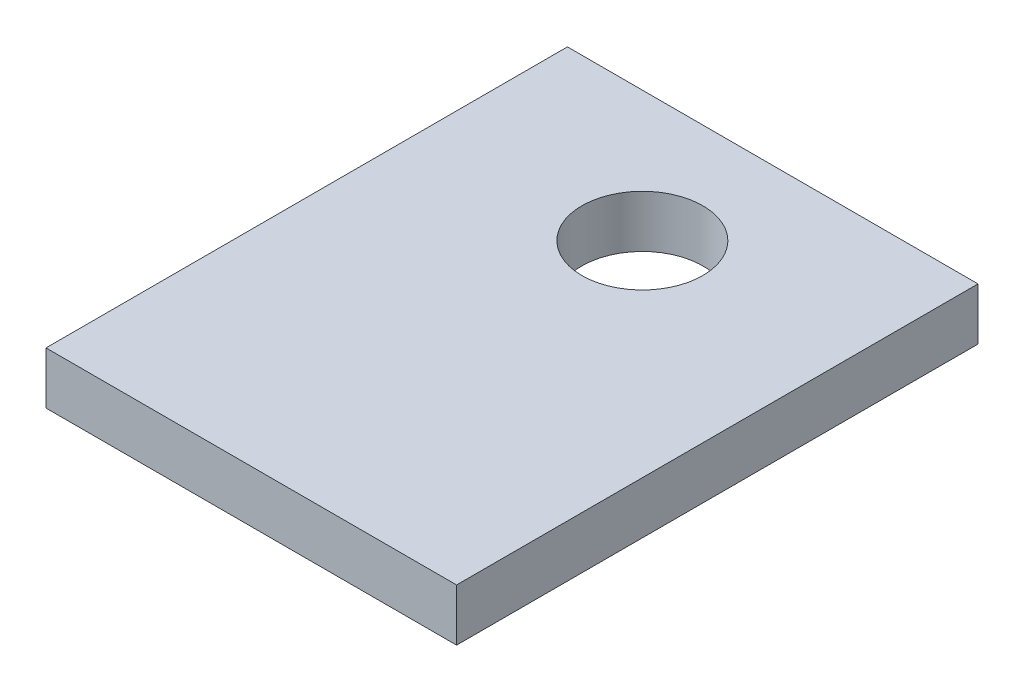
from build123d import *

# Parameters (mm, degrees)
SKETCH1_W           = 10
SKETCH1_H           = 12.7
SKETCH1_R           = 1.4732
BOSS_EXTRUDE1_DEPTH = 1.27


with BuildPart() as part:
    # Sketch1 → Boss-Extrude1 (new body)
    with BuildSketch(Plane(origin=(0, 0, 0), x_dir=(1, 0, 0), z_dir=(0, 1, 0))):
        with Locations((5, -6.35)):
            Rectangle(SKETCH1_W, SKETCH1_H)
        with Locations(Location((5, -3.175, 0), (0, 0, 270))):
            Circle(SKETCH1_R, mode=Mode.SUBTRACT)
    extrude(amount=BOSS_EXTRUDE1_DEPTH)


solid = part.part
